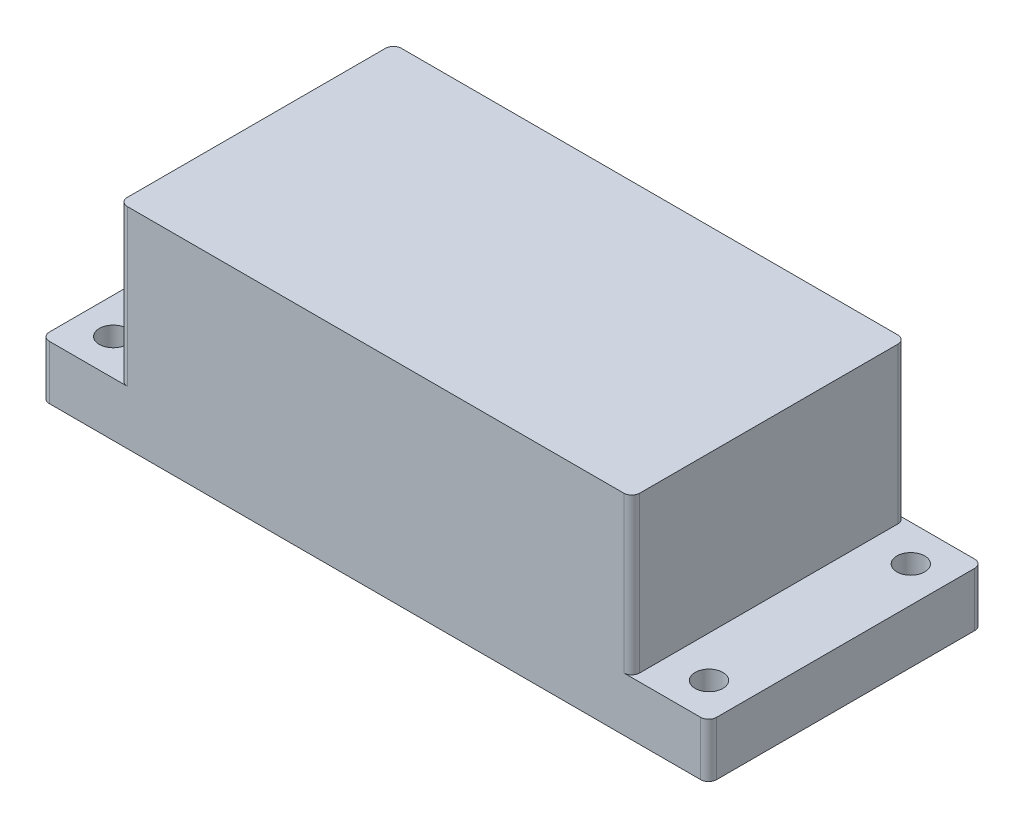
from build123d import *

# Parameters (mm, degrees)
SKETCH1_W           = 84
SKETCH1_H           = 34.5
BOSS_EXTRUDE1_DEPTH = 6.8
SKETCH2_W           = 64.5
SKETCH2_H           = 34.5
BOSS_EXTRUDE2_DEPTH = 19.6
SKETCH3_R           = 1.75
CUT_EXTRUDE1_DEPTH  = 6.8
FILLET1_R           = 1
FILLET2_R           = 1


with BuildPart() as part:
    # Sketch1 → Boss-Extrude1 (new body)
    with BuildSketch(Plane(origin=(0, 0, 0), x_dir=(1, 0, 0), z_dir=(0, 1, 0))):
        with Locations((25.748743719, -8.498743719)):
            Rectangle(SKETCH1_W, SKETCH1_H)
    extrude(amount=BOSS_EXTRUDE1_DEPTH)

    # Sketch2 → Boss-Extrude2 (add)
    with BuildSketch(Plane(origin=(0, 6.8, 0), x_dir=(1, 0, 0), z_dir=(0, 1, 0))):
        with Locations((25.824659205, -8.498743719)):
            Rectangle(SKETCH2_W, SKETCH2_H)
    extrude(amount=BOSS_EXTRUDE2_DEPTH)

    # Sketch3 → Cut-Extrude1 (cut)
    with BuildSketch(Plane(origin=(0, 6.8, 0), x_dir=(1, 0, 0), z_dir=(0, 1, 0))):
        with Locations(Location((63.248743719, 4.201256281, 0), (0, 0, 270))):
            Circle(SKETCH3_R)
        with Locations(Location((63.248743719, -21.198743719, 0), (0, 0, 270))):
            Circle(SKETCH3_R)
        with Locations(Location((-11.751256281, -21.198743719, 0), (0, 0, 270))):
            Circle(SKETCH3_R)
        with Locations(Location((-11.751256281, 4.201256281, 0), (0, 0, 270))):
            Circle(SKETCH3_R)
    extrude(amount=-CUT_EXTRUDE1_DEPTH, mode=Mode.SUBTRACT)

    # Fillet1
    fillet1_edges = [part.edges().sort_by_distance(p)[0] for p in [
        (-16.251256281, 3.4, -8.751256281),
        (67.748743719, 3.4, -8.751256281),
        (67.748743719, 3.4, 25.748743719),
        (-16.251256281, 3.4, 25.748743719),
    ]]
    fillet(fillet1_edges, radius=FILLET1_R)

    # Fillet2
    fillet2_edges = [part.edges().sort_by_distance(p)[0] for p in [
        (-6.425340795, 16.6, -8.751256281),
        (-6.425340795, 16.6, 25.748743719),
        (58.074659205, 16.6, 25.748743719),
        (58.074659205, 16.6, -8.751256281),
    ]]
    fillet(fillet2_edges, radius=FILLET2_R)


solid = part.part
